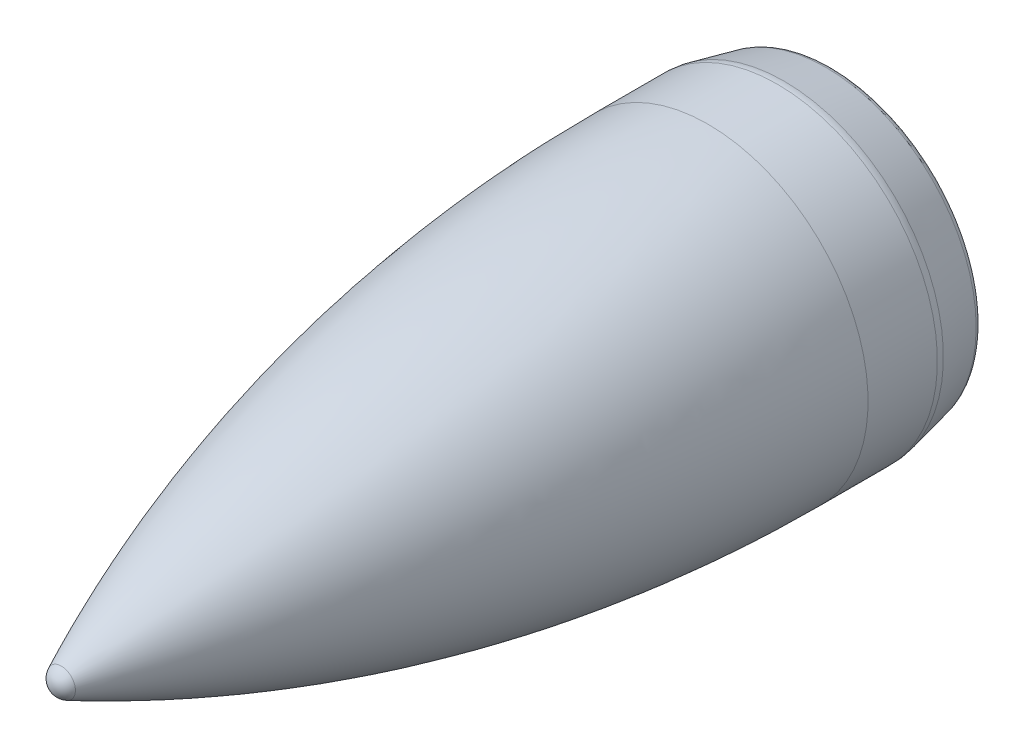
from build123d import *


with BuildPart() as part:
    # Sketch2 → Basic (Boat Tail) (revolve)
    with BuildSketch(Plane(origin=(0, 0, 0), x_dir=(0, 0, -1), z_dir=(1, 0, 0)), mode=Mode.PRIVATE) as basic_boat_tail_sk:
        with BuildLine():
            Line((-16.023408116, 0), (0, 0))
            Line((0, 0), (3.048, 0))
            Line((3.048, 0), (3.048, 3.466962537))
            ThreePointArc((3.048, 3.466962537), (3.003272527, 3.594150186), (2.88878053, 3.665345885))
            Line((2.88878053, 3.665345885), (1.859474413, 3.893537557))
            ThreePointArc((1.859474413, 3.893537557), (1.777503986, 3.90707093), (1.694547427, 3.9116))
            Line((1.694547427, 3.9116), (0, 3.9116))
            add(Edge.make_bspline(
                [(-15.806059792, 0.344062682), (-15.732658123, 0.378975815), (-15.5872123, 0.447397482), (-15.149699133, 0.650944906), (-14.681600853, 0.857658133), (-14.014163585, 1.143254029), (-13.316156675, 1.420650834), (-12.573807647, 1.700970995), (-11.848235301, 1.955184147), (-11.103931644, 2.200207389), (-10.362812016, 2.425686256), (-9.612087432, 2.637726581), (-8.860134943, 2.832464436), (-8.10228101, 3.0121039), (-7.342111585, 3.175171021), (-6.577659689, 3.322441704), (-5.811219133, 3.453331565), (-5.041028241, 3.5681016), (-4.270284693, 3.666499153), (-3.591630851, 3.738350546), (-3.012983586, 3.789672425), (-2.523895361, 3.825627048), (-2.143648517, 3.850278035), (-1.740246038, 3.870831388), (-1.377513769, 3.887272733), (-0.94485814, 3.899607712), (-0.630224141, 3.907830552), (-0.243605203, 3.910914664), (-0.081281751, 3.9116), (0, 3.9116)],
                knots=[0.083284636, 0.083284636, 0.083284636, 0.083284636, 0.083284636, 0.103185285, 0.123085934, 0.162887223, 0.202688468, 0.242489745, 0.28229104, 0.322092305, 0.361893565, 0.40169484, 0.441496119, 0.481297382, 0.521098653, 0.560899938, 0.600701203, 0.640502467, 0.680303746, 0.720105021, 0.759906291, 0.779806927, 0.799707563, 0.819608199, 0.839508836, 0.859409472, 0.879310108, 0.899210744, 0.91911138, 0.91911138, 0.91911138, 0.91911138, 0.91911138], degree=4))
            ThreePointArc((-15.806059792, 0.344062682), (-15.964520122, 0.203481831), (-16.023408116, 0))
        make_face()
    revolve(basic_boat_tail_sk.sketch.rotate(Axis((0, 0, 16.023408116), (0, 0, -1)), 180), axis=Axis((0, 0, 16.023408116), (0, 0, -1)))


solid = part.part
